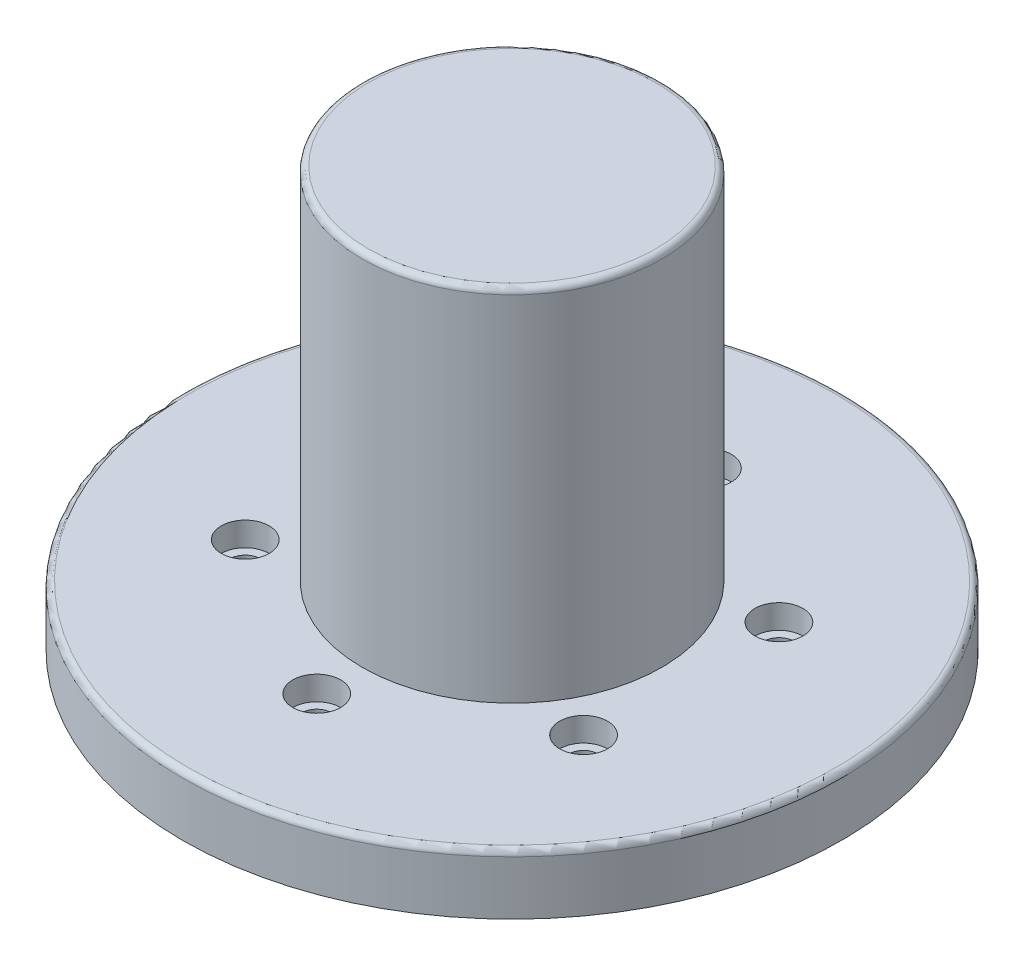
from build123d import *

# Parameters (mm, degrees)
SKETCH1_R           = 27.5
BOSS_EXTRUDE1_DEPTH = 5
SKETCH2_R           = 2
CUT_EXTRUDE1_DEPTH  = 2
SKETCH3_R           = 1.25
CUT_EXTRUDE2_DEPTH  = 40.210967853
CUT_EXTRUDE3_DEPTH  = 1.7
SKETCH5_R           = 12.5
BOSS_EXTRUDE2_DEPTH = 30
FILLET1_R           = 0.5


with BuildPart() as part:
    # Sketch1 → Boss-Extrude1 (new body)
    with BuildSketch(Plane(origin=(0, 0, 0), x_dir=(1, 0, 0), z_dir=(0, 1, 0))):
        with Locations(Location((0, 0, 0), (0, 0, 270))):
            Circle(SKETCH1_R)
    extrude(amount=BOSS_EXTRUDE1_DEPTH)

    # Sketch2 → Cut-Extrude1 (cut)
    with BuildSketch(Plane(origin=(0, 5, 0), x_dir=(1, 0, 0), z_dir=(0, 1, 0))):
        with Locations(Location((0, 16.3, 0), (0, 0, 270))):
            Circle(SKETCH2_R)
        with Locations(Location((14.116214082, 8.15, 0), (0, 0, 270))):
            Circle(SKETCH2_R)
        with Locations(Location((14.116214082, -8.15, 0), (0, 0, 270))):
            Circle(SKETCH2_R)
        with Locations(Location((0, -16.3, 0), (0, 0, 270))):
            Circle(SKETCH2_R)
        with Locations(Location((-14.116214082, -8.15, 0), (0, 0, 270))):
            Circle(SKETCH2_R)
        with Locations(Location((-14.116214082, 8.15, 0), (0, 0, 270))):
            Circle(SKETCH2_R)
    extrude(amount=-CUT_EXTRUDE1_DEPTH, mode=Mode.SUBTRACT)

    # Sketch3 → Cut-Extrude2 (cut, through all)
    with BuildSketch(Plane(origin=(0, 5, 0), x_dir=(1, 0, 0), z_dir=(0, 1, 0))):
        with Locations(Location((0, 16.3, 0), (0, 0, 270))):
            Circle(SKETCH3_R)
        with Locations(Location((14.116214082, 8.15, 0), (0, 0, 270))):
            Circle(SKETCH3_R)
        with Locations(Location((14.116214082, -8.15, 0), (0, 0, 270))):
            Circle(SKETCH3_R)
        with Locations(Location((0, -16.3, 0), (0, 0, 270))):
            Circle(SKETCH3_R)
        with Locations(Location((-14.116214082, -8.15, 0), (0, 0, 270))):
            Circle(SKETCH3_R)
        with Locations(Location((-14.116214082, 8.15, 0), (0, 0, 270))):
            Circle(SKETCH3_R)
    extrude(amount=-CUT_EXTRUDE2_DEPTH, mode=Mode.SUBTRACT)

    # Sketch4 → Cut-Extrude3 (cut)
    with BuildSketch(Plane.XZ):
        Polygon((12.116214082, 6.995299462), (14.116214082, 5.840598923), (16.116214082, 6.995299462), (16.116214082, 9.304700538), (14.116214082, 10.459401077), (12.116214082, 9.304700538), align=None)
        Polygon((0, 13.990598923), (2, 15.145299462), (2, 17.454700538), (0, 18.609401077), (-2, 17.454700538), (-2, 15.145299462), align=None)
        Polygon((12.116214082, -6.995299462), (12.116214082, -9.304700538), (14.116214082, -10.459401077), (16.116214082, -9.304700538), (16.116214082, -6.995299462), (14.116214082, -5.840598923), align=None)
        Polygon((0, -13.990598923), (-2, -15.145299462), (-2, -17.454700538), (0, -18.609401077), (2, -17.454700538), (2, -15.145299462), align=None)
        Polygon((-12.116214082, -6.995299462), (-14.116214082, -5.840598923), (-16.116214082, -6.995299462), (-16.116214082, -9.304700538), (-14.116214082, -10.459401077), (-12.116214082, -9.304700538), align=None)
        Polygon((-12.116214082, 6.995299462), (-12.116214082, 9.304700538), (-14.116214082, 10.459401077), (-16.116214082, 9.304700538), (-16.116214082, 6.995299462), (-14.116214082, 5.840598923), align=None)
    extrude(amount=-CUT_EXTRUDE3_DEPTH, mode=Mode.SUBTRACT)

    # Sketch5 → Boss-Extrude2 (add)
    with BuildSketch(Plane(origin=(0, 5, 0), x_dir=(1, 0, 0), z_dir=(0, 1, 0))):
        with Locations(Location((0, 0, 0), (0, 0, 270))):
            Circle(SKETCH5_R)
    extrude(amount=BOSS_EXTRUDE2_DEPTH)

    # Fillet1
    fillet1_edges = [part.edges().sort_by_distance(p)[0] for p in [
        (0, 35, -12.5),
        (0, 5, -27.5),
    ]]
    fillet(fillet1_edges, radius=FILLET1_R)


solid = part.part
